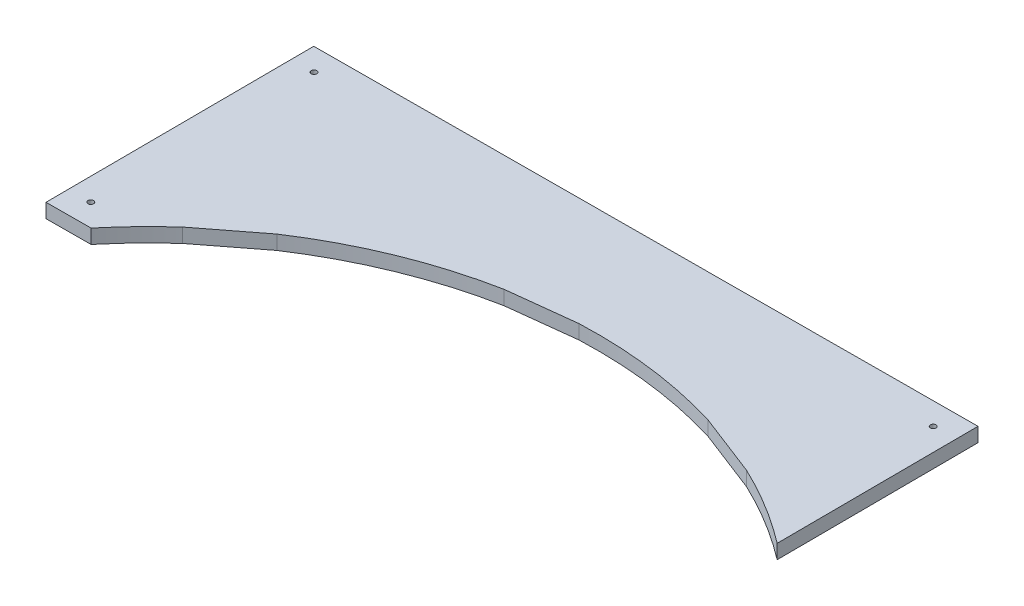
from build123d import *

# Parameters (mm, degrees)
SKETCH1_R           = 1.25
BOSS_EXTRUDE1_DEPTH = 6.35


with BuildPart() as part:
    # Sketch1 → Boss-Extrude1 (new body)
    with BuildSketch(Plane(origin=(0, 0, 0), x_dir=(1, 0, 0), z_dir=(0, 1, 0))):
        with BuildLine():
            Line((19.999792019, 0.091209594), (0, 0))
            Line((0, 0), (-0.547257564, 119.998752115))
            Line((-0.547257564, 119.998752115), (294.449674718, 121.344093627))
            Line((294.449674718, 121.344093627), (294.86012216, 31.344093627))
            ThreePointArc((294.86012216, 31.344093627), (277.870515385, 42.942471612), (259.779400189, 52.734338707))
            Line((259.779400189, 52.734338707), (231.756657954, 63.5857763))
            ThreePointArc((231.756657954, 63.5857763), (199.118358441, 70.566953886), (165.773569429, 72.023141123))
            Line((165.773569429, 72.023141123), (135.773569429, 68.543550593))
            ThreePointArc((135.773569429, 68.543550593), (98.326093616, 57.414966094), (63.756361786, 39.21901932))
            Line((63.756361786, 39.21901932), (40.005697256, 20.884351348))
            ThreePointArc((40.005697256, 20.884351348), (29.627268731, 10.849040712), (19.999792019, 0.091209594))
        make_face()
        with Locations(Location((9.498243242, 110.044460902, 0), (0, 0, 270))):
            Circle(SKETCH1_R, mode=Mode.SUBTRACT)
        with Locations(Location((9.954291213, 10.045500807, 0), (0, 0, 270))):
            Circle(SKETCH1_R, mode=Mode.SUBTRACT)
        with Locations(Location((284.495383506, 111.298592821, 0), (0, 0, 270))):
            Circle(SKETCH1_R, mode=Mode.SUBTRACT)
    extrude(amount=BOSS_EXTRUDE1_DEPTH)


solid = part.part
